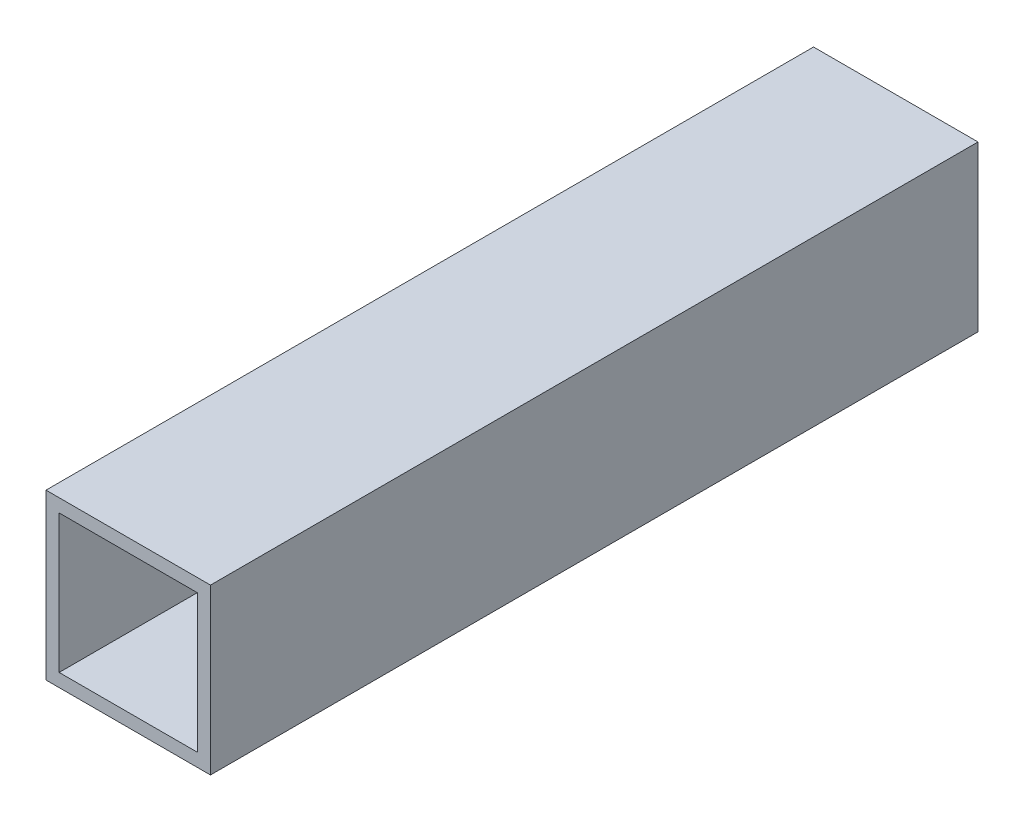
from build123d import *

# Parameters (mm, degrees)
SKETCH_1_W      = 15
SKETCH_1_H      = 15
SKETCH_1_W_2    = 12.6
SKETCH_1_H_2    = 12.6
EXTRUDE_1_DEPTH = 70


with BuildPart() as part:
    # 草图1 → 凸台-拉伸1 (new body)
    with BuildSketch(Plane.XY):
        Rectangle(SKETCH_1_W, SKETCH_1_H)
        Rectangle(SKETCH_1_W_2, SKETCH_1_H_2, mode=Mode.SUBTRACT)
    extrude(amount=EXTRUDE_1_DEPTH)


solid = part.part
